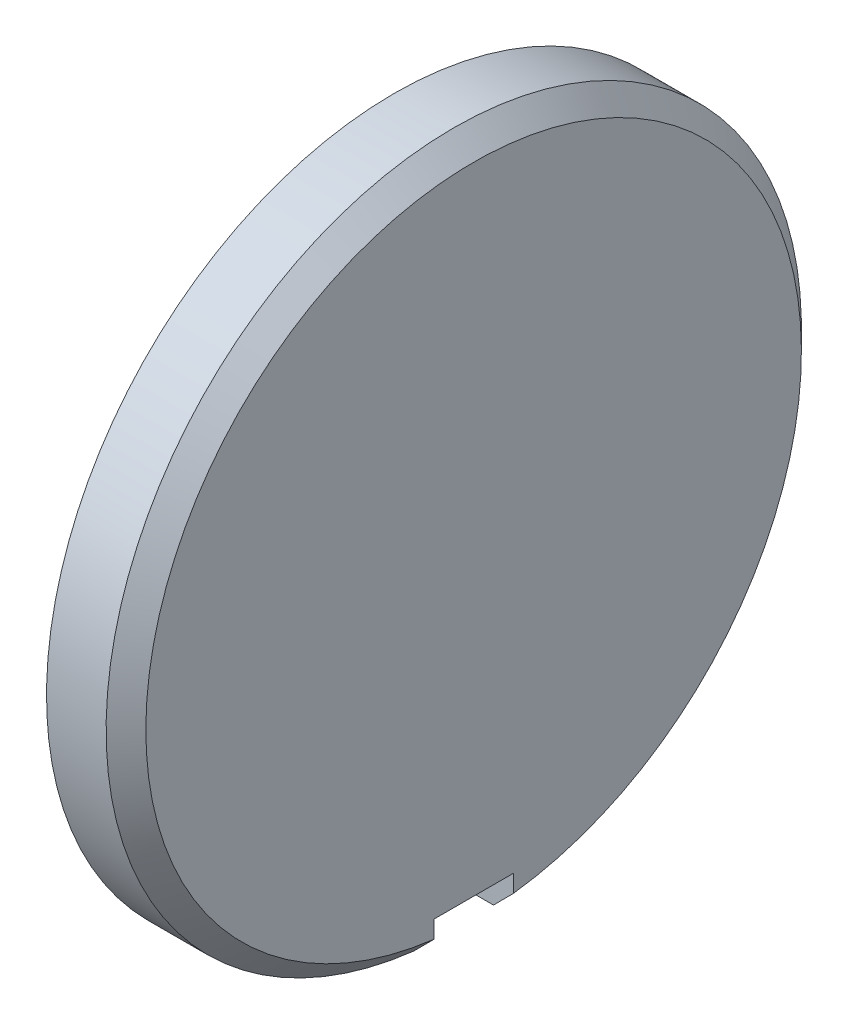
from build123d import *

# Parameters (mm, degrees)
BOSS_EXTRUDE1_START = 62.8
SKETCH2_W           = 1.28
SKETCH2_H           = 0.8
BOSS_EXTRUDE1_DEPTH = 6.4
BOSS_EXTRUDE2_START = 65.6
SKETCH3_W           = 1.28
SKETCH3_H           = 6.4
BOSS_EXTRUDE2_DEPTH = 0.8
BOSS_EXTRUDE3_START = 65.2
SKETCH4_W           = 1.8
SKETCH4_H           = 0.9
BOSS_EXTRUDE3_DEPTH = 1.6


with BuildPart() as part:
    # Sketch1 → Revolve1 (revolve)
    with BuildSketch(Plane.XY.offset(66)):
        Polygon((82.8, -62.7), (84, -62.7), (84, -65), (85.6, -65), (85.6, -58.4), (85.2, -58), (84, -58), (84, -62), (82.8, -62), align=None)
    revolve(axis=Axis((77.8, -65, 66), (1, 0, 0)))


with BuildPart() as body_2:
    # Sketch2 → Boss-Extrude1 (new body)
    with BuildSketch(Plane.XY.offset(BOSS_EXTRUDE1_START)):
        with Locations((83.34, -65)):
            Rectangle(SKETCH2_W, SKETCH2_H)
    extrude(amount=BOSS_EXTRUDE1_DEPTH)


with BuildPart() as part_1:
    add(part.part)

    # Combine1: cut body 2
    add(body_2.part, mode=Mode.SUBTRACT)


with BuildPart() as body_2_2:
    # Sketch3 → Boss-Extrude2 (new body)
    with BuildSketch(Plane.XY.offset(BOSS_EXTRUDE2_START)):
        with Locations((83.34, -65)):
            Rectangle(SKETCH3_W, SKETCH3_H)
    extrude(amount=BOSS_EXTRUDE2_DEPTH)


with BuildPart() as part_2:
    add(part_1.part)

    # Combine2: cut body 2 2
    add(body_2_2.part, mode=Mode.SUBTRACT)


with BuildPart() as body_2_3:
    # Sketch4 → Boss-Extrude3 (new body)
    with BuildSketch(Plane.XY.offset(BOSS_EXTRUDE3_START)):
        with Locations((84.8, -71.65)):
            Rectangle(SKETCH4_W, SKETCH4_H)
    extrude(amount=BOSS_EXTRUDE3_DEPTH)


with BuildPart() as part_3:
    add(part_2.part)

    # Combine3: cut body 2 3
    add(body_2_3.part, mode=Mode.SUBTRACT)


solid = part_3.part
